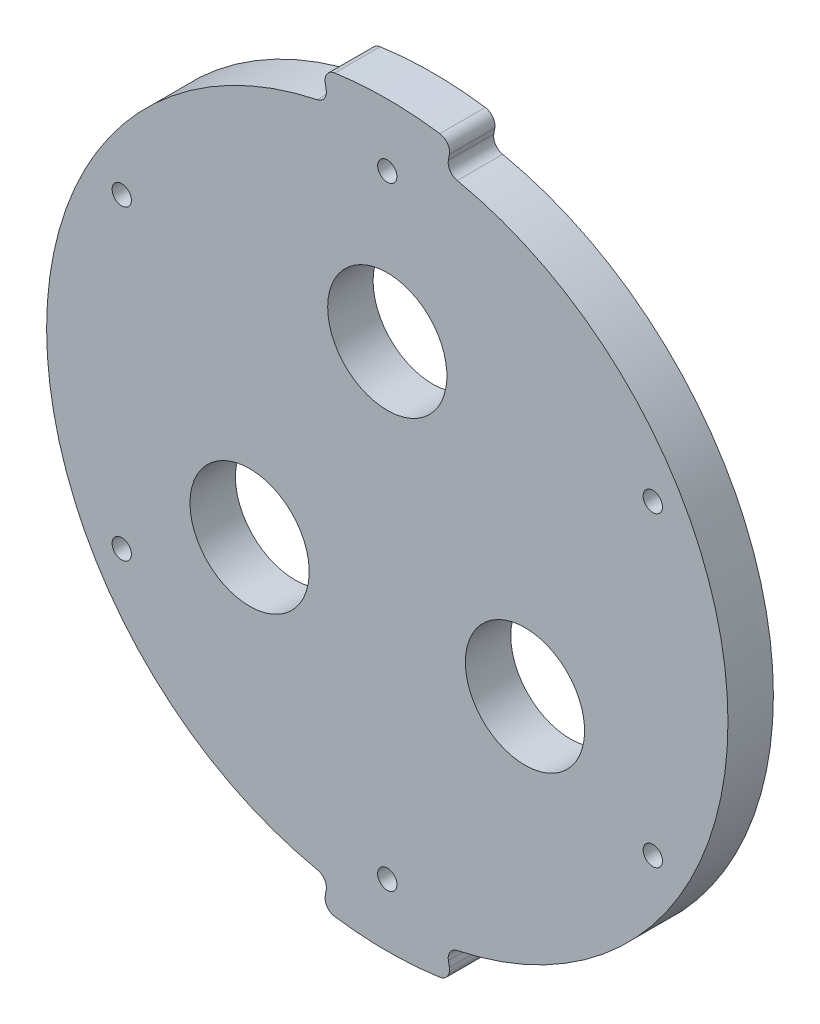
from build123d import *

# Parameters (mm, degrees)
SKETCH_1_R                   = 60
EXTRUDE_1_DEPTH              = 8
EXTRUDE_START                = -8
EXTRUDE_2_DEPTH              = 8
FILLET_1_R                   = 2
HOLE_WIZARD_M3_1_D           = 3.4
HOLE_WIZARD_M3_1_CSINK_D     = 3.45
HOLE_WIZARD_M3_1_CSINK_ANGLE = 82
SKETCH_8_R                   = 10.5
CUT_EXTRUDE_1_DEPTH          = 89.820042783


with BuildPart() as part:
    # ｽｹｯﾁ1 → ﾎﾞｽ - 押し出し1 (new body)
    with BuildSketch(Plane.XY):
        Circle(SKETCH_1_R)
    extrude(amount=EXTRUDE_1_DEPTH)

    # ｽｹｯﾁ2 → ﾎﾞｽ - 押し出し2 (add)
    with BuildSketch(Plane.XY.offset(8).offset(EXTRUDE_START)):
        with BuildLine():
            Line((10.41889066, 59.088465181), (11.287131548, 64.012503946))
            ThreePointArc((11.287131548, 64.012503946), (0, 65), (-11.287131548, 64.012503946))
            Line((-11.287131548, 64.012503946), (-10.41889066, 59.088465181))
            ThreePointArc((-10.41889066, 59.088465181), (0, 60), (10.41889066, 59.088465181))
        make_face()
        with BuildLine():
            Line((10.41889066, -59.088465181), (11.287131548, -64.012503946))
            ThreePointArc((11.287131548, -64.012503946), (0, -65), (-11.287131548, -64.012503946))
            Line((-11.287131548, -64.012503946), (-10.41889066, -59.088465181))
            ThreePointArc((-10.41889066, -59.088465181), (0, -60), (10.41889066, -59.088465181))
        make_face()
    extrude(amount=EXTRUDE_2_DEPTH)

    # ﾌｨﾚｯﾄ1
    fillet_1_edges = [part.edges().sort_by_distance(p)[0] for p in [
        (-10.41889066, -59.088465181, 4),
        (10.41889066, -59.088465181, 4),
        (11.287131548, -64.012503946, 4),
        (-11.287131548, -64.012503946, 4),
        (10.41889066, 59.088465181, 4),
        (-10.41889066, 59.088465181, 4),
        (-11.287131548, 64.012503946, 4),
        (11.287131548, 64.012503946, 4),
    ]]
    fillet(fillet_1_edges, radius=FILLET_1_R)

    # M3 すきま穴1 (through all)
    with Locations(Plane(origin=(0, 0, 0), x_dir=(-1, 0, 0), z_dir=(0, 0, -1))):
        with Locations((0, 54), (46.765371804, 27), (46.765371804, -27), (0, -54), (-46.765371804, -27), (-46.765371804, 27)):
            CounterSinkHole(HOLE_WIZARD_M3_1_D / 2, HOLE_WIZARD_M3_1_CSINK_D / 2, counter_sink_angle=HOLE_WIZARD_M3_1_CSINK_ANGLE)

    # ｽｹｯﾁ8 → ｶｯﾄ - 押し出し1 (cut, through all)
    with BuildSketch(Plane(origin=(0, 0, 0), x_dir=(-1, 0, 0), z_dir=(0, 0, -1))):
        with Locations((0, 28)):
            Circle(SKETCH_8_R)
        with Locations((24.248711306, -14)):
            Circle(SKETCH_8_R)
        with Locations((-24.248711306, -14)):
            Circle(SKETCH_8_R)
    extrude(amount=-CUT_EXTRUDE_1_DEPTH, mode=Mode.SUBTRACT)


solid = part.part
